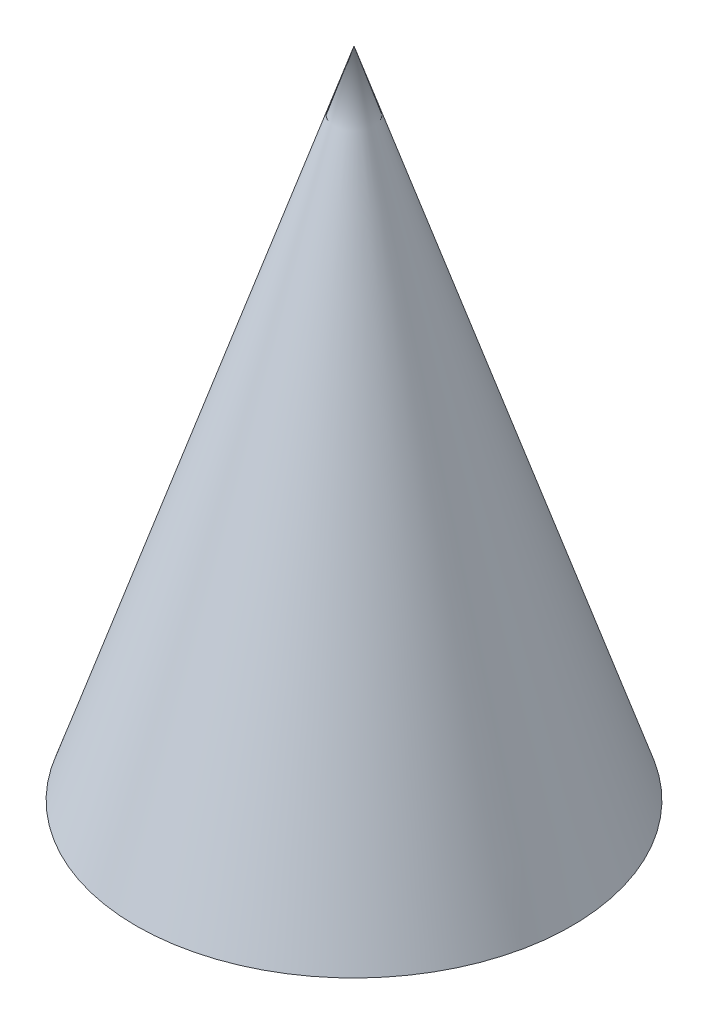
from build123d import *

# Parameters (mm, degrees)
SKETCH_1_R = 10


with BuildPart() as part:
    # 草图1 → 放样1 section 0
    with BuildSketch(Plane(origin=(0, 0, 0), x_dir=(1, 0, 0), z_dir=(0, 1, 0)), mode=Mode.PRIVATE) as loft_1_s0:
        Circle(SKETCH_1_R)
    loft([Vertex(0, 30, 0), loft_1_s0.sketch])


solid = part.part
